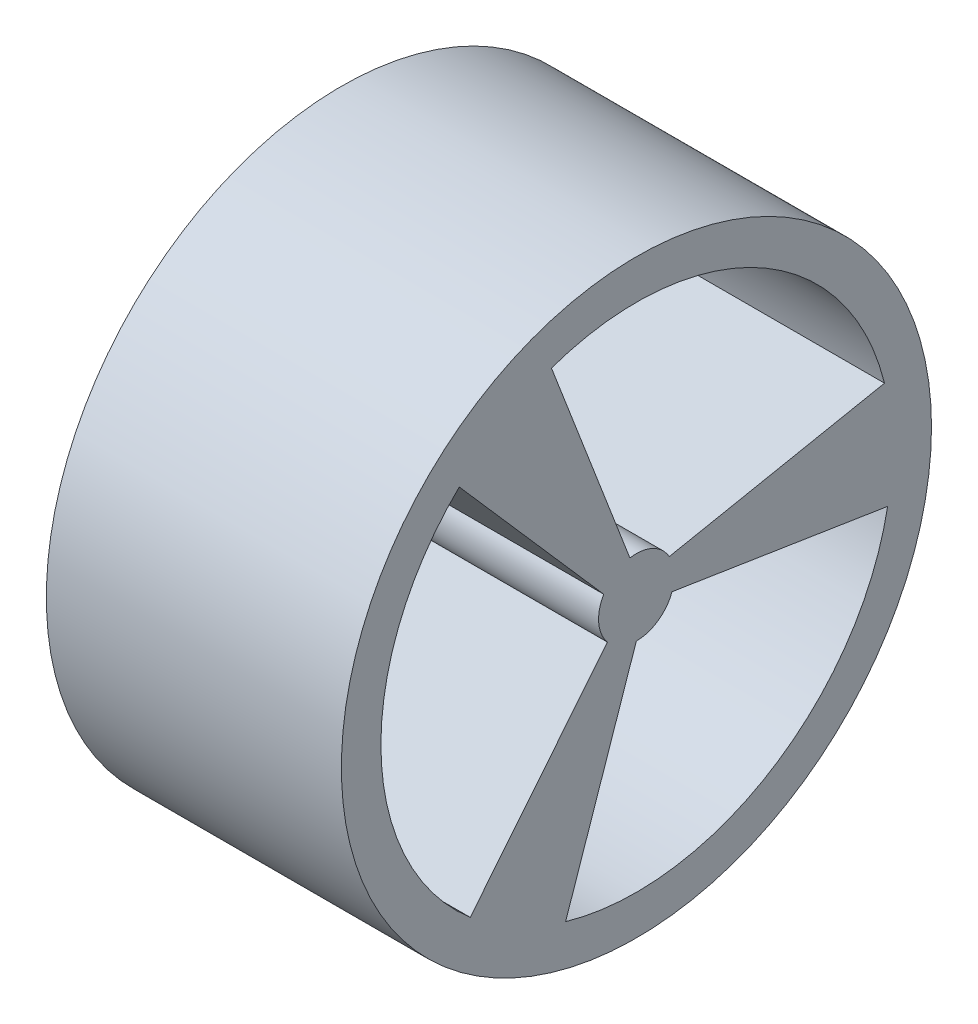
from build123d import *

# Parameters (mm, degrees)
SKETCH1_R               = 10
BOSS_EXTRUDE1_DEPTH     = 10
CUT_EXTRUDE1_DEPTH      = 18.320508076
CUT_EXTRUDE1_DEPTH_BACK = 18.320508076


with BuildPart() as part:
    # Sketch1 → Boss-Extrude1 (new body)
    with BuildSketch(Plane(origin=(0, 0, 0), x_dir=(0, 0, -1), z_dir=(1, 0, 0))):
        Circle(SKETCH1_R)
    extrude(amount=BOSS_EXTRUDE1_DEPTH)

    # Sketch2 → Cut-Extrude1 (cut, two sides: drawn at the far end of the back side and taken through both)
    with BuildSketch(Plane(origin=(10, 0, 0), x_dir=(0, 0, -1), z_dir=(1, 0, 0)).offset(-CUT_EXTRUDE1_DEPTH_BACK)):
        with BuildLine():
            Line((-6.005338319, 6.239789308), (-1.110102081, 0.645057171))
            ThreePointArc((-1.110102081, 0.645057171), (-1.279247043, -0.109326976), (-0.98454757, -0.824070062))
            Line((-0.98454757, -0.824070062), (-5.632597517, -6.578214359))
            ThreePointArc((-5.632597517, -6.578214359), (-8.656540425, -0.251727641), (-6.005338319, 6.239789308))
        make_face()
        with BuildLine():
            Line((8.406485214, 2.080880889), (1.113686937, 0.638848017))
            ThreePointArc((1.113686937, 0.638848017), (0.544943583, 1.162523924), (-0.221391823, 1.264678237))
            Line((-0.221391823, 1.264678237), (-2.880601988, 8.167079718))
            ThreePointArc((-2.880601988, 8.167079718), (4.110267681, 7.622647737), (8.406485214, 2.080880889))
        make_face()
        with BuildLine():
            Line((-2.401146895, -8.320670197), (-0.003584856, -1.283905188))
            ThreePointArc((-0.003584856, -1.283905188), (0.73430346, -1.053196949), (1.205939393, -0.440608176))
            Line((1.205939393, -0.440608176), (8.513199505, -1.588865359))
            ThreePointArc((8.513199505, -1.588865359), (4.546272744, -7.370920096), (-2.401146895, -8.320670197))
        make_face()
    extrude(amount=CUT_EXTRUDE1_DEPTH + CUT_EXTRUDE1_DEPTH_BACK, mode=Mode.SUBTRACT)


solid = part.part
